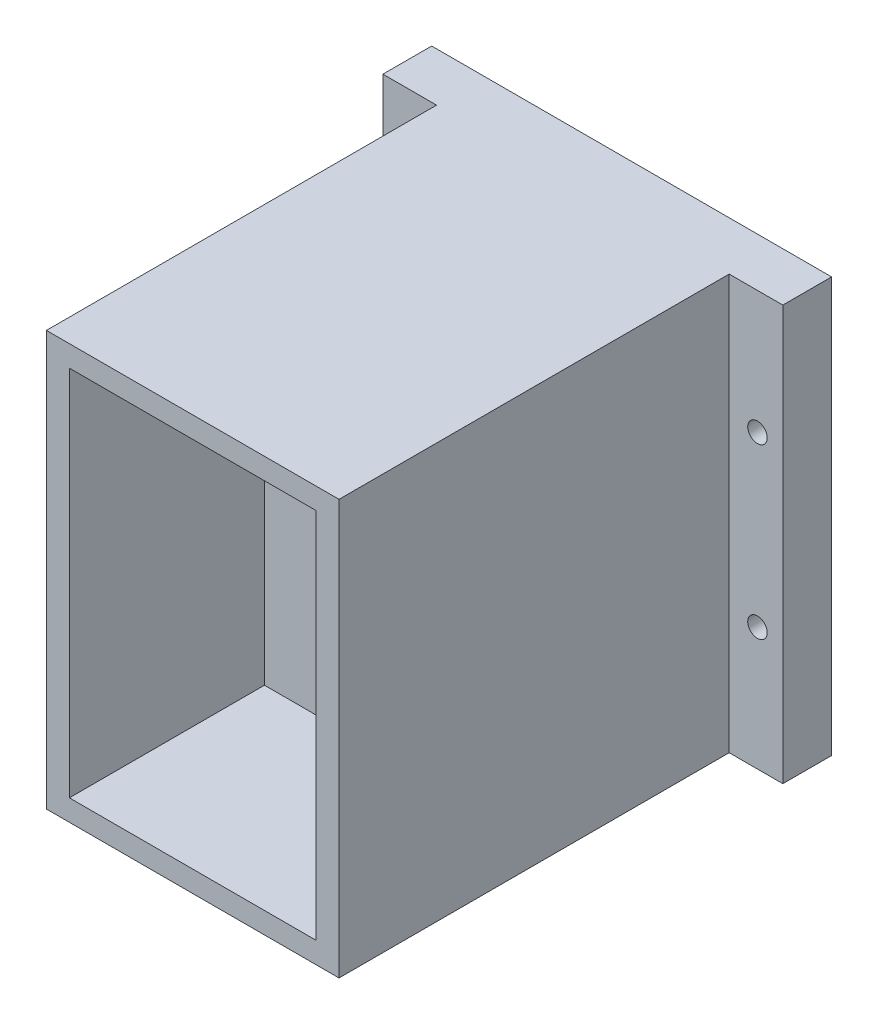
from build123d import *

# Parameters (mm, degrees)
SKETCH_1_W          = 30
SKETCH_1_H          = 42.5
EXTRUDE_1_DEPTH     = 40
SKETCH_2_W          = 25.29109927
SKETCH_2_H          = 38.153739886
CUT_EXTRUDE_1_DEPTH = 20
SKETCH_3_R          = 10
CUT_EXTRUDE_2_DEPTH = 1
SKETCH_4_W          = 41
SKETCH_4_H          = 42.5
SKETCH_4_R          = 1
EXTRUDE_2_DEPTH     = 5


with BuildPart() as part:
    # 草图1 → 凸台-拉伸1 (new body)
    with BuildSketch(Plane.XY):
        Rectangle(SKETCH_1_W, SKETCH_1_H)
    extrude(amount=EXTRUDE_1_DEPTH)

    # 草图2 → 切除-拉伸1 (cut)
    with BuildSketch(Plane.XY.offset(40)):
        Rectangle(SKETCH_2_W, SKETCH_2_H)
    extrude(amount=-CUT_EXTRUDE_1_DEPTH, mode=Mode.SUBTRACT)

    # 草图3 → 切除-拉伸2 (cut)
    with BuildSketch(Plane(origin=(0, 0, 0), x_dir=(-1, 0, 0), z_dir=(0, 0, -1))):
        Circle(SKETCH_3_R)
    extrude(amount=-CUT_EXTRUDE_2_DEPTH, mode=Mode.SUBTRACT)

    # 草图4 → 凸台-拉伸2 (add)
    with BuildSketch(Plane(origin=(0, 0, 0), x_dir=(-1, 0, 0), z_dir=(0, 0, -1))):
        Rectangle(SKETCH_4_W, SKETCH_4_H)
        with Locations((17.9, 8.65)):
            Circle(SKETCH_4_R, mode=Mode.SUBTRACT)
        with Locations(Location((-17.9, 8.65, 0), (0, 0, 180))):
            Circle(SKETCH_4_R, mode=Mode.SUBTRACT)
        with Locations((-17.9, -8.65)):
            Circle(SKETCH_4_R, mode=Mode.SUBTRACT)
        with Locations(Location((17.9, -8.65, 0), (0, 0, 180))):
            Circle(SKETCH_4_R, mode=Mode.SUBTRACT)
    extrude(amount=EXTRUDE_2_DEPTH)


solid = part.part
